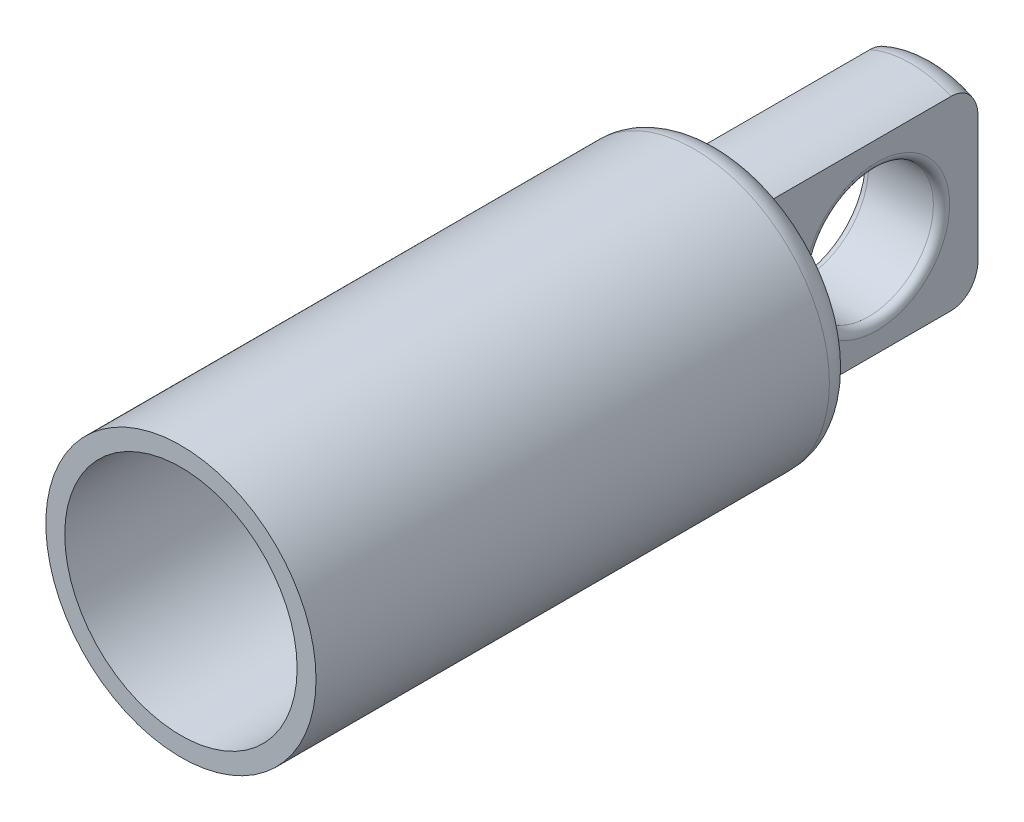
from build123d import *

# Parameters (mm, degrees)
SKETCH1_R           = 6.35
BOSS_EXTRUDE1_DEPTH = 25.4
SHELL1_T            = -0.889
FILLET1_R           = 1.27
SKETCH2_R           = 4.7625
BOSS_EXTRUDE2_DEPTH = 10.16
CUT_EXTRUDE1_START  = -10.16
CUT_EXTRUDE1_DEPTH  = 10.16
SKETCH4_R           = 3.048
CUT_EXTRUDE2_DEPTH  = 28.452277251
FILLET2_R           = 0.381
FILLET3_R           = 1.27


with BuildPart() as part:
    # Sketch1 → Boss-Extrude1 (new body)
    with BuildSketch(Plane.XY):
        Circle(SKETCH1_R)
    extrude(amount=BOSS_EXTRUDE1_DEPTH)

    # Shell1
    shell1_openings = [part.faces().sort_by_distance(p)[0] for p in [
        (0, 0, 25.4),
    ]]
    offset(amount=SHELL1_T, openings=shell1_openings, kind=Kind.INTERSECTION)

    # Fillet1
    fillet1_edges = [part.edges().sort_by_distance(p)[0] for p in [
        (-6.35, 0, 0),
    ]]
    fillet(fillet1_edges, radius=FILLET1_R)

    # Sketch2 → Boss-Extrude2 (add)
    with BuildSketch(Plane(origin=(0, 0, 0), x_dir=(-1, 0, 0), z_dir=(0, 0, -1))):
        with Locations(Location((0, 0, 0), (0, 0, 180))):
            Circle(SKETCH2_R)
    extrude(amount=BOSS_EXTRUDE2_DEPTH)

    # Sketch3 → Cut-Extrude1 (cut)
    with BuildSketch(Plane(origin=(0, 0, -10.16), x_dir=(-1, 0, 0), z_dir=(0, 0, -1)).offset(CUT_EXTRUDE1_START)):
        with BuildLine():
            Line((-1.905, 4.364903349), (-1.905, -4.364903349))
            ThreePointArc((-1.905, -4.364903349), (-4.7625, 0), (-1.905, 4.364903349))
        make_face()
        with BuildLine():
            Line((1.905, 4.364903349), (1.905, -4.364903349))
            ThreePointArc((1.905, -4.364903349), (4.7625, 0), (1.905, 4.364903349))
        make_face()
    extrude(amount=CUT_EXTRUDE1_DEPTH, mode=Mode.SUBTRACT)

    # Sketch4 → Cut-Extrude2 (cut, through all)
    with BuildSketch(Plane(origin=(1.905, 0, 0), x_dir=(0, 0, -1), z_dir=(1, 0, 0))):
        with Locations((5.3975, 0)):
            Circle(SKETCH4_R)
    extrude(amount=-CUT_EXTRUDE2_DEPTH, mode=Mode.SUBTRACT)

    # Fillet2
    fillet2_edges = [part.edges().sort_by_distance(p)[0] for p in [
        (-1.905, 0, -2.3495),
        (1.905, 0, -2.3495),
    ]]
    fillet(fillet2_edges, radius=FILLET2_R)

    # Fillet3
    fillet3_edges = [part.edges().sort_by_distance(p)[0] for p in [
        (0, 4.7625, -10.16),
        (0, -4.7625, -10.16),
    ]]
    fillet(fillet3_edges, radius=FILLET3_R)


solid = part.part
